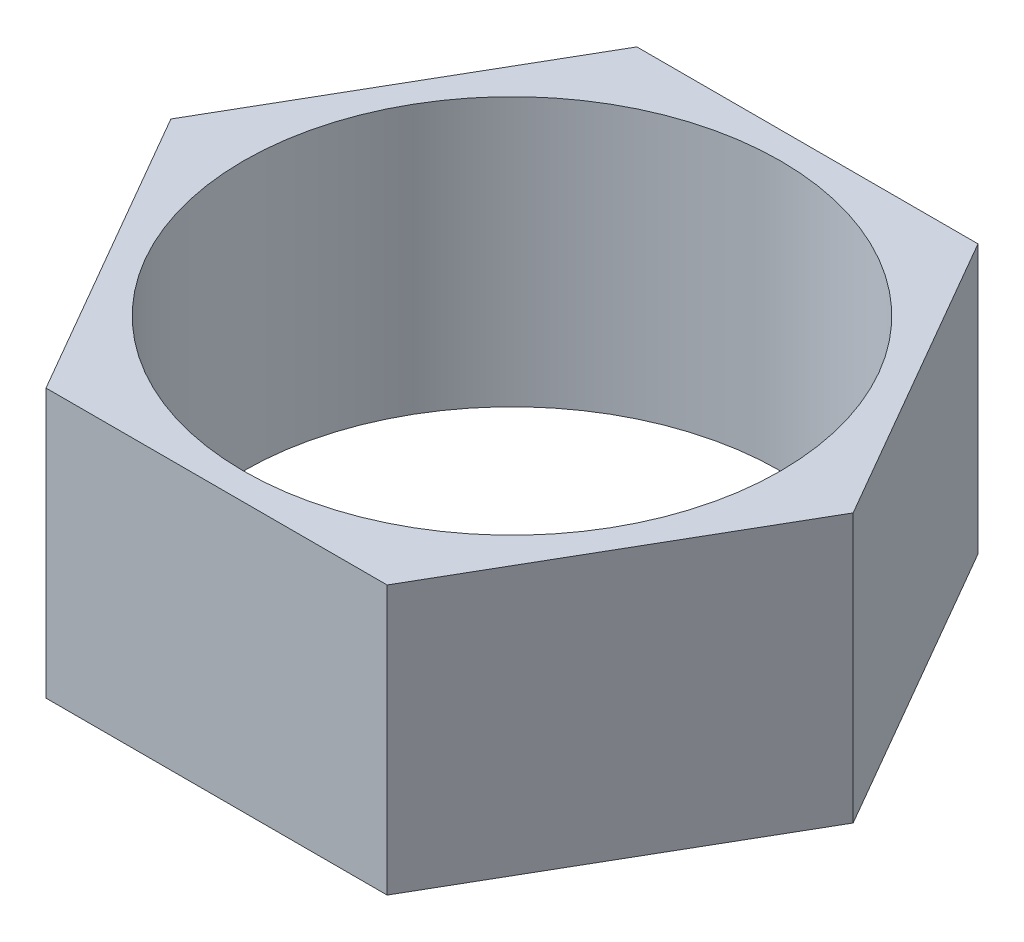
from build123d import *

# Parameters (mm, degrees)
SKETCH1_R           = 10
BOSS_EXTRUDE2_DEPTH = 10


with BuildPart() as part:
    # Sketch1 → Boss-Extrude2 (new body)
    with BuildSketch(Plane(origin=(0, 0, 0), x_dir=(1, 0, 0), z_dir=(0, 1, 0))):
        Polygon((12.701705922, 0), (6.350852961, 11), (-6.350852961, 11), (-12.701705922, 0), (-6.350852961, -11), (6.350852961, -11), align=None)
        with Locations(Location((0, 0, 0), (0, 0, 270))):
            Circle(SKETCH1_R, mode=Mode.SUBTRACT)
    extrude(amount=BOSS_EXTRUDE2_DEPTH)


solid = part.part
